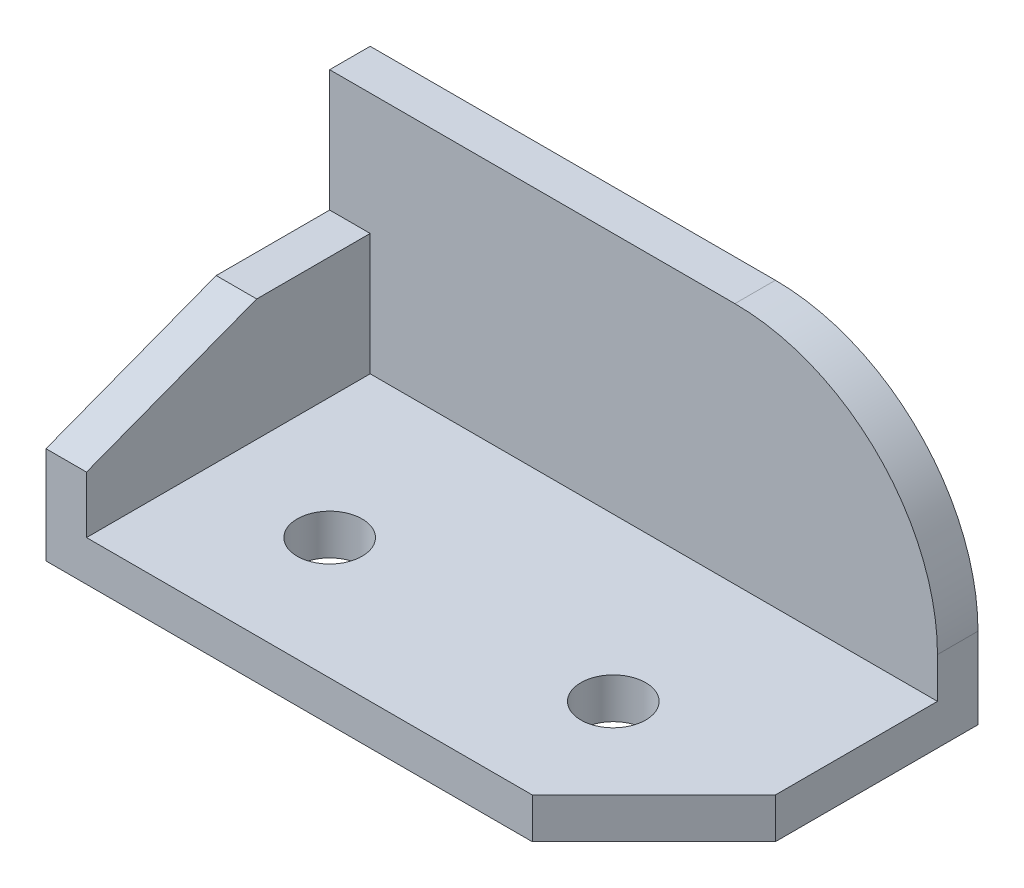
from build123d import *

# Parameters (mm, degrees)
BOSS_EXTRUDE1_DEPTH = 5
BOSS_EXTRUDE2_DEPTH = 5
BOSS_EXTRUDE3_DEPTH = 5


with BuildPart() as part:
    # Sketch1 → Boss-Extrude1 (new body)
    with BuildSketch(Plane(origin=(0, 0, 0), x_dir=(1, 0, 0), z_dir=(0, 1, 0))):
        with BuildLine():
            Line((60, 0), (0, 0))
            Line((0, 0), (0, -25))
            Line((0, -25), (16, -25))
            ThreePointArc((16, -25), (20, -21), (24, -25))
            Line((24, -25), (51, -25))
            ThreePointArc((51, -25), (55, -21), (59, -25))
            Line((59, -25), (75, -25))
            Line((75, -25), (75, 0))
            Line((75, 0), (60, 0))
        make_face()
        with BuildLine():
            Line((16, -25), (0, -25))
            Line((0, -25), (0, -40))
            Line((0, -40), (60, -40))
            Line((60, -40), (75, -25))
            Line((75, -25), (59, -25))
            ThreePointArc((59, -25), (55, -29), (51, -25))
            Line((51, -25), (24, -25))
            ThreePointArc((24, -25), (20, -29), (16, -25))
        make_face()
    extrude(amount=BOSS_EXTRUDE1_DEPTH)

    # Sketch2 → Boss-Extrude2 (add)
    with BuildSketch(Plane.ZY):
        Polygon((40, 0), (40, 12), (19, 20), (0, 20), (0, 0), align=None)
    extrude(amount=-BOSS_EXTRUDE2_DEPTH)

    # Sketch3 → Boss-Extrude3 (add)
    with BuildSketch(Plane(origin=(0, 0, 0), x_dir=(-1, 0, 0), z_dir=(0, 0, -1))):
        with BuildLine():
            Line((-5, 20), (0, 20))
            Line((0, 20), (0, 35))
            Line((0, 35), (-50, 35))
            ThreePointArc((-50, 35), (-67.67766953, 27.67766953), (-75, 10))
            Line((-75, 10), (-75, 5))
            Line((-75, 5), (-60, 5))
            Line((-60, 5), (-5, 5))
            Line((-5, 5), (-5, 20))
        make_face()
    extrude(amount=-BOSS_EXTRUDE3_DEPTH)


solid = part.part
